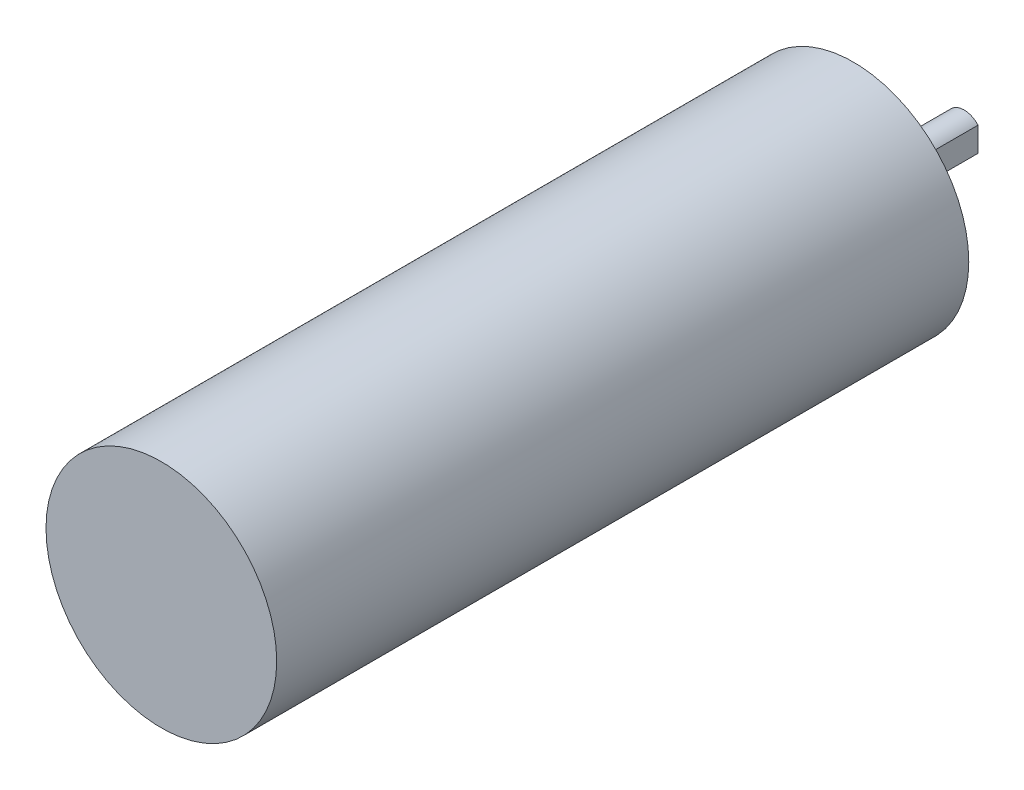
from build123d import *

# Parameters (mm, degrees)
SKETCH1_R    = 2
SHAFT_DEPTH  = 12
SKETCH2_R    = 12.5
BODY_DEPTH   = 75
SKETCH3_W    = 3
SKETCH3_H    = 6
D_FLAT_DEPTH = 10


with BuildPart() as part:
    # Sketch1 → Shaft (new body)
    with BuildSketch(Plane.XY):
        Circle(SKETCH1_R)
    extrude(amount=SHAFT_DEPTH)

    # Sketch2 → Body (add)
    with BuildSketch(Plane.XY.offset(12)):
        Circle(SKETCH2_R)
    extrude(amount=BODY_DEPTH)

    # Sketch3 → D_flat (cut)
    with BuildSketch(Plane.XY):
        with Locations((3, 0)):
            Rectangle(SKETCH3_W, SKETCH3_H)
    extrude(amount=D_FLAT_DEPTH, mode=Mode.SUBTRACT)


solid = part.part
